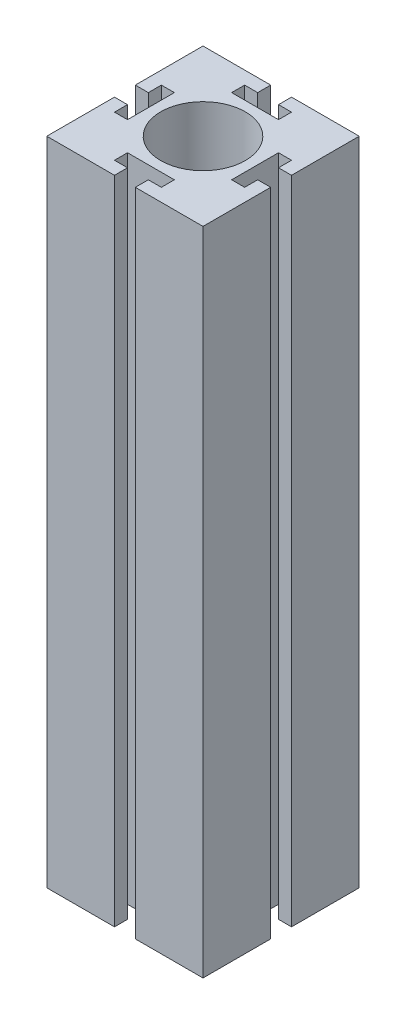
from build123d import *

# Parameters (mm, degrees)
ESQUISSE1_W             = 12
ESQUISSE1_H             = 12
BOSS_EXTRU_1_DEPTH      = 50
ENL_V_MAT_EXTRU_1_DEPTH = 50
ESQUISSE3_R             = 3.25
ENL_V_MAT_EXTRU_2_DEPTH = 47
ESQUISSE4_R             = 1.5
ENL_V_MAT_EXTRU_3_DEPTH = 3


with BuildPart() as part:
    # Esquisse1 → Boss.-Extru.1 (new body)
    with BuildSketch(Plane(origin=(0, 0, 0), x_dir=(1, 0, 0), z_dir=(0, 1, 0))):
        Rectangle(ESQUISSE1_W, ESQUISSE1_H)
    extrude(amount=BOSS_EXTRU_1_DEPTH)

    # Esquisse2 → Enlèv. mat.-Extru.1 (cut)
    with BuildSketch(Plane(origin=(0, 50, 0), x_dir=(1, 0, 0), z_dir=(0, 1, 0))):
        Polygon((-5, -0.8), (-5, -1.8), (-4, -1.8), (-4, 1.8), (-5, 1.8), (-5, 0.8), (-6, 0.8), (-6, -0.8), align=None)
        Polygon((1.8, 5), (1.8, 4), (-1.8, 4), (-1.8, 5), (-0.8, 5), (-0.8, 6), (0.8, 6), (0.8, 5), align=None)
        Polygon((5, -1.8), (4, -1.8), (4, 1.8), (5, 1.8), (5, 0.8), (6, 0.8), (6, -0.8), (5, -0.8), align=None)
        Polygon((-1.8, -5), (-1.8, -4), (1.8, -4), (1.8, -5), (0.8, -5), (0.8, -6), (-0.8, -6), (-0.8, -5), align=None)
    extrude(amount=-ENL_V_MAT_EXTRU_1_DEPTH, mode=Mode.SUBTRACT)

    # Esquisse3 → Enlèv. mat.-Extru.2 (cut)
    with BuildSketch(Plane(origin=(0, 50, 0), x_dir=(1, 0, 0), z_dir=(0, 1, 0))):
        with Locations(Location((0, 0, 0), (0, 0, 270))):
            Circle(ESQUISSE3_R)
    extrude(amount=-ENL_V_MAT_EXTRU_2_DEPTH, mode=Mode.SUBTRACT)

    # Esquisse4 → Enlèv. mat.-Extru.3 (cut)
    with BuildSketch(Plane(origin=(0, 3, 0), x_dir=(1, 0, 0), z_dir=(0, 1, 0))):
        with Locations(Location((0, 0, 0), (0, 0, 270))):
            Circle(ESQUISSE4_R)
    extrude(amount=-ENL_V_MAT_EXTRU_3_DEPTH, mode=Mode.SUBTRACT)


solid = part.part
